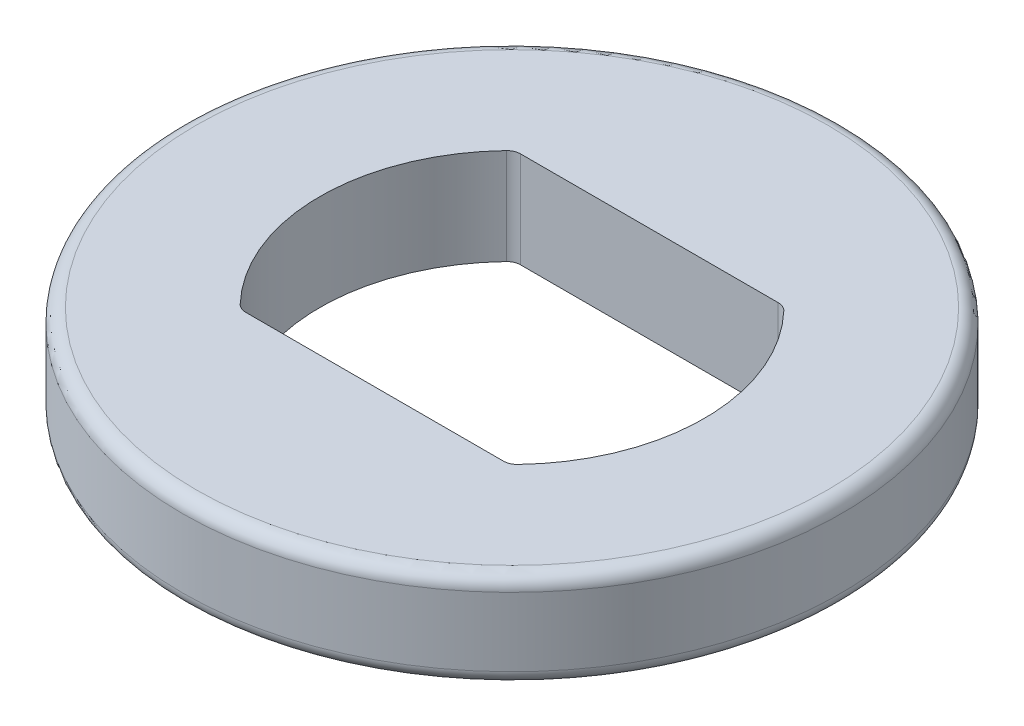
from build123d import *

# Parameters (mm, degrees)
SKETCH_1_R          = 12
EXTRUDE_1_DEPTH     = 3.5
CUT_EXTRUDE_1_DEPTH = 18.327723451
FILLET_1_R          = 0.5


with BuildPart() as part:
    # 草图1 → 凸台-拉伸1 (new body)
    with BuildSketch(Plane(origin=(0, 0, 0), x_dir=(1, 0, 0), z_dir=(0, 1, 0))):
        with Locations(Location((0, 0, 0), (0, 0, 270))):
            Circle(SKETCH_1_R)
    extrude(amount=EXTRUDE_1_DEPTH)

    # 草图2 → 切除-拉伸1 (cut, through all)
    with BuildSketch(Plane.XZ):
        with BuildLine():
            Line((4.898979486, -5), (-4.898979486, -5))
            ThreePointArc((-4.898979486, -5), (-7, 0), (-4.898979486, 5))
            Line((-4.898979486, 5), (4.898979486, 5))
            ThreePointArc((4.898979486, 5), (7, 0), (4.898979486, -5))
        make_face()
    extrude(amount=-CUT_EXTRUDE_1_DEPTH, mode=Mode.SUBTRACT)

    # 圆角1
    fillet_1_edges = [part.edges().sort_by_distance(p)[0] for p in [
        (4.898979486, 1.75, -5),
        (-4.898979486, 1.75, -5),
        (-4.898979486, 1.75, 5),
        (0, 0, -12),
        (0, 3.5, -12),
        (4.898979486, 1.75, 5),
    ]]
    fillet(fillet_1_edges, radius=FILLET_1_R)


solid = part.part
